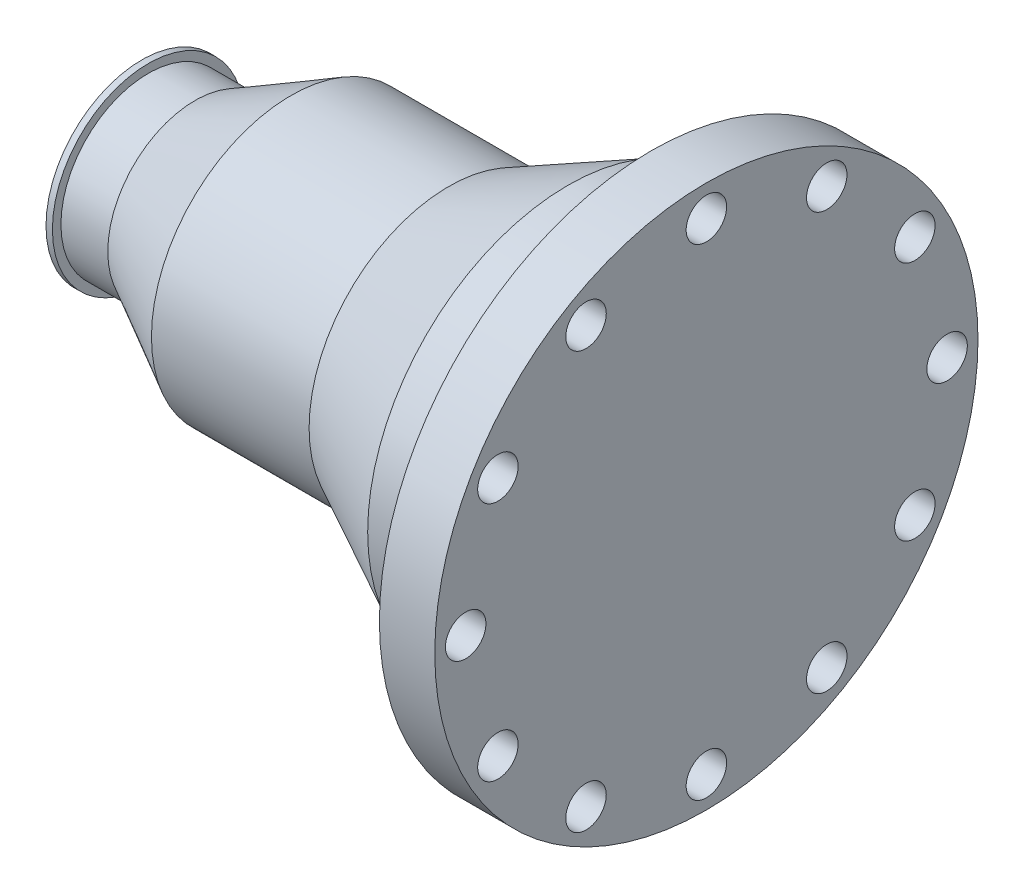
from build123d import *

# Parameters (mm, degrees)
SKETCH_2_R           = 9.5
CUT_EXTRUDE_1_DEPTH  = 321.526909947
SKETCH_3_R           = 9.5
CUT_EXTRUDE_2_DEPTH  = 321.526909947
SKETCH_4_R           = 9.5
CUT_EXTRUDE_3_DEPTH  = 321.526909947
SKETCH_5_R           = 9.5
CUT_EXTRUDE_4_DEPTH  = 321.526909947
SKETCH_6_R           = 9.5
CUT_EXTRUDE_5_DEPTH  = 321.526909947
SKETCH_7_R           = 9.5
CUT_EXTRUDE_6_DEPTH  = 321.526909947
SKETCH_8_R           = 9.5
CUT_EXTRUDE_7_DEPTH  = 321.526909947
SKETCH_9_R           = 9.5
CUT_EXTRUDE_8_DEPTH  = 321.526909947
SKETCH_10_R          = 9.5
CUT_EXTRUDE_9_DEPTH  = 321.526909947
SKETCH_11_R          = 9.5
CUT_EXTRUDE_10_DEPTH = 321.526909947
SKETCH_12_R          = 9.5
CUT_EXTRUDE_11_DEPTH = 321.526909947
SKETCH_13_R          = 9.5
CUT_EXTRUDE_12_DEPTH = 321.526909947


with BuildPart() as part:
    # Эскиз1 → Повернуть1 (revolve)
    with BuildSketch(Plane.XY, mode=Mode.PRIVATE) as revolve_1_sk:
        Polygon((0, 0), (265, 0), (265, 127.5), (239, 127.5), (239, 100), (239, 95), (220, 95), (220, 94), (200, 94), (144, 65.5), (70, 65.5), (25, 41), (3, 41), (3, 45), (0, 45), align=None)
    revolve(revolve_1_sk.sketch.rotate(Axis((0, 0, 0), (1, 0, 0)), 90), axis=Axis((0, 0, 0), (1, 0, 0)))

    # Эскиз2 → Вырез-Вытянуть1 (cut, through all)
    with BuildSketch(Plane(origin=(0, 0, 0), x_dir=(0, 0, -1), z_dir=(1, 0, 0))):
        with Locations((0, 113)):
            Circle(SKETCH_2_R)
    extrude(amount=CUT_EXTRUDE_1_DEPTH, mode=Mode.SUBTRACT)

    # Эскиз3 → Вырез-Вытянуть2 (cut, through all)
    with BuildSketch(Plane(origin=(0, 0, 0), x_dir=(0, 0, -1), z_dir=(1, 0, 0))):
        with Locations((-56.5, 97.860870628)):
            Circle(SKETCH_3_R)
    extrude(amount=CUT_EXTRUDE_2_DEPTH, mode=Mode.SUBTRACT)

    # Эскиз4 → Вырез-Вытянуть3 (cut, through all)
    with BuildSketch(Plane(origin=(0, 0, 0), x_dir=(0, 0, -1), z_dir=(1, 0, 0))):
        with Locations((-97.860870628, 56.5)):
            Circle(SKETCH_4_R)
    extrude(amount=CUT_EXTRUDE_3_DEPTH, mode=Mode.SUBTRACT)

    # Эскиз5 → Вырез-Вытянуть4 (cut, through all)
    with BuildSketch(Plane(origin=(0, 0, 0), x_dir=(0, 0, -1), z_dir=(1, 0, 0))):
        with Locations((-113, 0)):
            Circle(SKETCH_5_R)
    extrude(amount=CUT_EXTRUDE_4_DEPTH, mode=Mode.SUBTRACT)

    # Эскиз6 → Вырез-Вытянуть5 (cut, through all)
    with BuildSketch(Plane(origin=(0, 0, 0), x_dir=(0, 0, -1), z_dir=(1, 0, 0))):
        with Locations((-97.860870628, -56.5)):
            Circle(SKETCH_6_R)
    extrude(amount=CUT_EXTRUDE_5_DEPTH, mode=Mode.SUBTRACT)

    # Эскиз7 → Вырез-Вытянуть6 (cut, through all)
    with BuildSketch(Plane(origin=(0, 0, 0), x_dir=(0, 0, -1), z_dir=(1, 0, 0))):
        with Locations((-56.5, -97.860870628)):
            Circle(SKETCH_7_R)
    extrude(amount=CUT_EXTRUDE_6_DEPTH, mode=Mode.SUBTRACT)

    # Эскиз8 → Вырез-Вытянуть7 (cut, through all)
    with BuildSketch(Plane(origin=(0, 0, 0), x_dir=(0, 0, -1), z_dir=(1, 0, 0))):
        with Locations((0, -113)):
            Circle(SKETCH_8_R)
    extrude(amount=CUT_EXTRUDE_7_DEPTH, mode=Mode.SUBTRACT)

    # Эскиз9 → Вырез-Вытянуть8 (cut, through all)
    with BuildSketch(Plane(origin=(0, 0, 0), x_dir=(0, 0, -1), z_dir=(1, 0, 0))):
        with Locations((56.5, -97.860870628)):
            Circle(SKETCH_9_R)
    extrude(amount=CUT_EXTRUDE_8_DEPTH, mode=Mode.SUBTRACT)

    # Эскиз10 → Вырез-Вытянуть9 (cut, through all)
    with BuildSketch(Plane(origin=(0, 0, 0), x_dir=(0, 0, -1), z_dir=(1, 0, 0))):
        with Locations((97.860870628, -56.5)):
            Circle(SKETCH_10_R)
    extrude(amount=CUT_EXTRUDE_9_DEPTH, mode=Mode.SUBTRACT)

    # Эскиз11 → Вырез-Вытянуть10 (cut, through all)
    with BuildSketch(Plane(origin=(0, 0, 0), x_dir=(0, 0, -1), z_dir=(1, 0, 0))):
        with Locations((113, 0)):
            Circle(SKETCH_11_R)
    extrude(amount=CUT_EXTRUDE_10_DEPTH, mode=Mode.SUBTRACT)

    # Эскиз12 → Вырез-Вытянуть11 (cut, through all)
    with BuildSketch(Plane(origin=(0, 0, 0), x_dir=(0, 0, -1), z_dir=(1, 0, 0))):
        with Locations((97.860870628, 56.5)):
            Circle(SKETCH_12_R)
    extrude(amount=CUT_EXTRUDE_11_DEPTH, mode=Mode.SUBTRACT)

    # Эскиз13 → Вырез-Вытянуть12 (cut, through all)
    with BuildSketch(Plane(origin=(0, 0, 0), x_dir=(0, 0, -1), z_dir=(1, 0, 0))):
        with Locations((56.5, 97.860870628)):
            Circle(SKETCH_13_R)
    extrude(amount=CUT_EXTRUDE_12_DEPTH, mode=Mode.SUBTRACT)


solid = part.part
